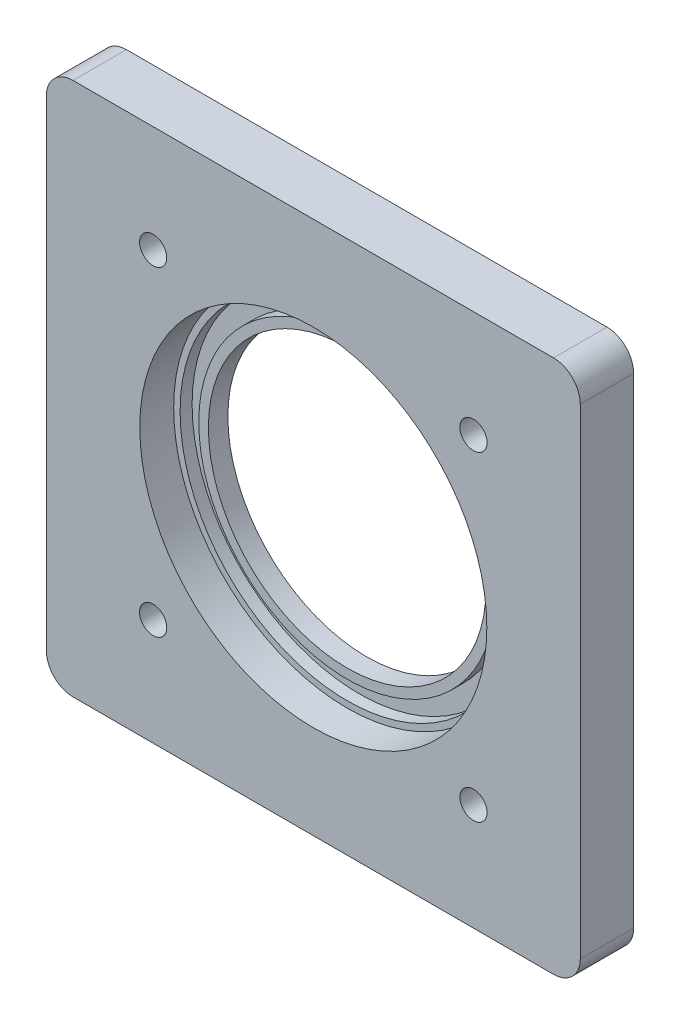
from build123d import *

# Parameters (mm, degrees)
SKETCH1_W                  = 100
SKETCH1_H                  = 100
BOSS_EXTRUDE1_DEPTH        = 10
HOLE1_D                    = 62.6
HOLE1_DEPTH                = 8.6
SKETCH4_W                  = 27.8
SKETCH4_H                  = 2.25
SKETCH5_W                  = 1.2
SKETCH5_H                  = 6.35
F_10_CLEARANCE_HOLE1_D     = 5.1
F_10_CLEARANCE_HOLE1_DEPTH = 6
HOLE2_D                    = 52
FILLET1_R                  = 5


with BuildPart() as part:
    # Sketch1 → Boss-Extrude1 (new body)
    with BuildSketch(Plane(origin=(0, 0, 0), x_dir=(-1, 0, 0), z_dir=(0, 0, -1))):
        with Locations((-50, 50)):
            Rectangle(SKETCH1_W, SKETCH1_H)
    extrude(amount=-BOSS_EXTRUDE1_DEPTH)

    # Hole1
    with Locations(Plane.XY.offset(10)):
        with Locations((50, 50)):
            Hole(HOLE1_D / 2, depth=HOLE1_DEPTH)

    # Sketch4 → Revolve1 (revolve)
    with BuildSketch(Plane.XZ.offset(-50)):
        with Locations((63.9, 2.525)):
            Rectangle(SKETCH4_W, SKETCH4_H)
    revolve(axis=Axis((50, 50, 3.65), (0, 0, -1)))

    # Sketch5 → Cut-Revolve1 (revolve, cut)
    with BuildSketch(Plane.XZ.offset(-50), mode=Mode.PRIVATE) as cut_revolve1_sk:
        with Locations((81.9, 6.825)):
            Rectangle(SKETCH5_W, SKETCH5_H)
    revolve(cut_revolve1_sk.sketch.rotate(Axis((50, 50, 10), (0, 0, -1)), 180), axis=Axis((50, 50, 10), (0, 0, -1)), mode=Mode.SUBTRACT)

    # #10 Clearance Hole1
    with Locations(Plane.XY.offset(10)):
        with Locations((80, 80), (80, 20), (20, 20), (20, 80)):
            Hole(F_10_CLEARANCE_HOLE1_D / 2, depth=F_10_CLEARANCE_HOLE1_DEPTH)

    # Hole2 (through all)
    with Locations(Plane.XY.offset(3.65)):
        with Locations((50, 50)):
            Hole(HOLE2_D / 2)

    # Fillet1
    fillet1_edges = [part.edges().sort_by_distance(p)[0] for p in [
        (100, 100, 5),
        (0, 100, 5),
        (0, 0, 5),
        (100, 0, 5),
    ]]
    fillet(fillet1_edges, radius=FILLET1_R)


solid = part.part
